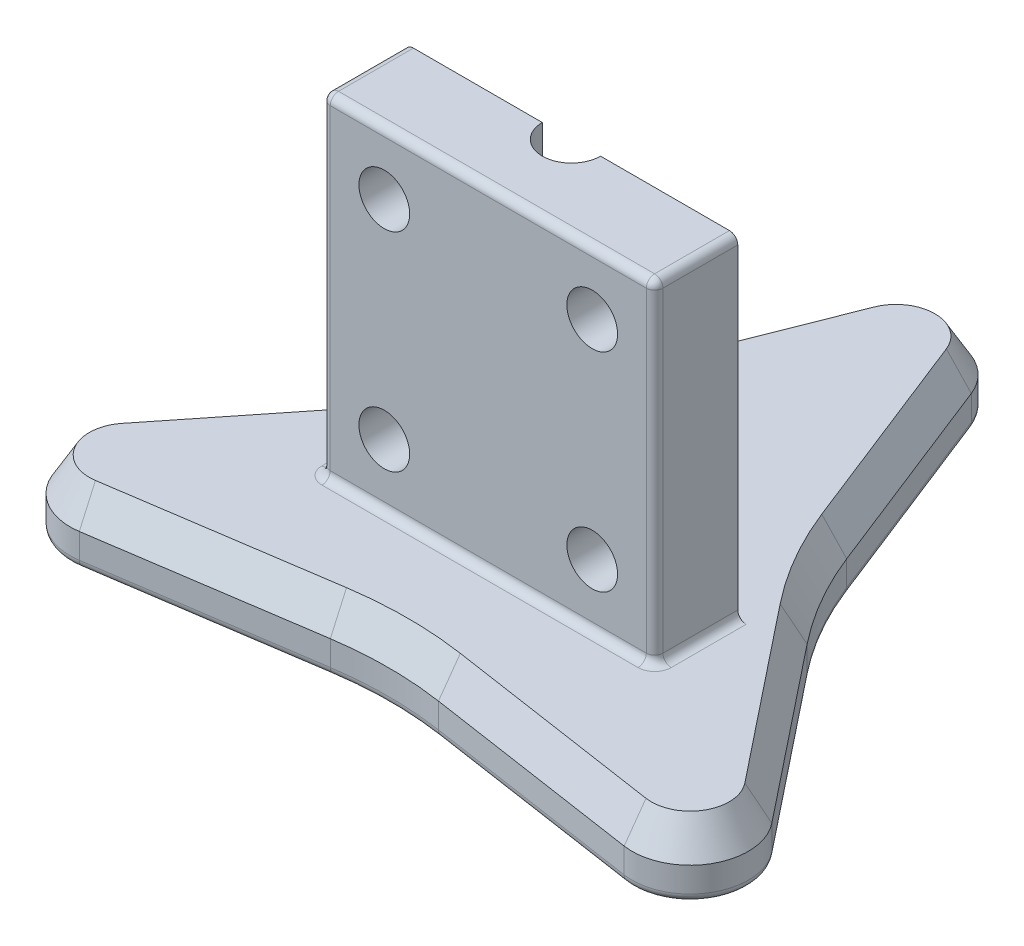
from build123d import *
from OCP.BRepFilletAPI import BRepFilletAPI_MakeChamfer

# Parameters (mm, degrees)
EXTRUDE2_DEPTH     = 8
CHAMFER2_SIZE      = 4
CHAMFER2_SIZE2     = 2.309401077
CUT_EXTRUDE1_DEPTH = 3
EXTRUDE3_START     = 8
EXTRUDE3_DEPTH     = 40
SKETCH4_R          = 3.05
CUT_EXTRUDE2_DEPTH = 78.989993783
FILLET1_R          = 1


with BuildPart() as part:
    # Sketch1 → Extrude2 (new body)
    with BuildSketch(Plane(origin=(0, 0, 0), x_dir=(1, 0, 0), z_dir=(0, 1, 0))):
        with BuildLine():
            Line((-6.5, 41.572883869), (-16.221725084, 16.871170844))
            ThreePointArc((-16.221725084, 16.871170844), (-17.527996386, 13.882959965), (-19.052558883, 11))
            ThreePointArc((-19.052558883, 11), (-20.786994202, 8.238210165), (-22.721725084, 5.612840594))
            Line((-22.721725084, 5.612840594), (-39.253173539, -15.15727681))
            ThreePointArc((-39.253173539, -15.15727681), (-39.837168574, -23), (-32.753173539, -26.415607059))
            Line((-32.753173539, -26.415607059), (-6.5, -22.484011438))
            ThreePointArc((-6.5, -22.484011438), (-3.258997817, -22.12117013), (0, -22))
            ThreePointArc((0, -22), (3.258997817, -22.12117013), (6.5, -22.484011438))
            Line((6.5, -22.484011438), (32.753173539, -26.415607059))
            ThreePointArc((32.753173539, -26.415607059), (39.837168574, -23), (39.253173539, -15.15727681))
            Line((39.253173539, -15.15727681), (22.721725084, 5.612840594))
            ThreePointArc((22.721725084, 5.612840594), (20.786994202, 8.238210165), (19.052558883, 11))
            ThreePointArc((19.052558883, 11), (17.527996386, 13.882959965), (16.221725084, 16.871170844))
            Line((16.221725084, 16.871170844), (6.5, 41.572883869))
            ThreePointArc((6.5, 41.572883869), (0, 46), (-6.5, 41.572883869))
        make_face()
    extrude(amount=EXTRUDE2_DEPTH)

    # Chamfer2: one chamfer whose edges measure the first distance from different faces: ONE call of the kernel's chamfer builder (chamfer() names one face for all edges)
    chamfer2_edges_1 = [part.edges().sort_by_distance(p)[0] for p in [
        (-19.052558883, 8, -11),
    ]]
    chamfer2_side_1 = [part.faces().sort_by_distance(p)[0] for p in [
        (-19.052558883, 4, -11),
    ]]
    chamfer2_edges_2 = [part.edges().sort_by_distance(p)[0] for p in [
        (-30.987449312, 8, 4.772218108),
    ]]
    chamfer2_side_2 = [part.faces().sort_by_distance(p)[0] for p in [
        (-30.987449312, 4, 4.772218108),
    ]]
    chamfer2_edges_3 = [part.edges().sort_by_distance(p)[0] for p in [
        (-39.837168574, 8, 23),
    ]]
    chamfer2_side_3 = [part.faces().sort_by_distance(p)[0] for p in [
        (-39.837168574, 4, 23),
    ]]
    chamfer2_edges_4 = [part.edges().sort_by_distance(p)[0] for p in [
        (-19.626586769, 8, 24.449809248),
    ]]
    chamfer2_side_4 = [part.faces().sort_by_distance(p)[0] for p in [
        (-19.626586769, 4, 24.449809248),
    ]]
    chamfer2_edges_5 = [part.edges().sort_by_distance(p)[0] for p in [
        (0, 8, 22),
    ]]
    chamfer2_side_5 = [part.faces().sort_by_distance(p)[0] for p in [
        (0, 4, 22),
    ]]
    chamfer2_edges_6 = [part.edges().sort_by_distance(p)[0] for p in [
        (19.626586769, 8, 24.449809248),
    ]]
    chamfer2_side_6 = [part.faces().sort_by_distance(p)[0] for p in [
        (19.626586769, 4, 24.449809248),
    ]]
    chamfer2_edges_7 = [part.edges().sort_by_distance(p)[0] for p in [
        (39.837168574, 8, 23),
    ]]
    chamfer2_side_7 = [part.faces().sort_by_distance(p)[0] for p in [
        (39.837168574, 4, 23),
    ]]
    chamfer2_edges_8 = [part.edges().sort_by_distance(p)[0] for p in [
        (30.987449312, 8, 4.772218108),
    ]]
    chamfer2_side_8 = [part.faces().sort_by_distance(p)[0] for p in [
        (30.987449312, 4, 4.772218108),
    ]]
    chamfer2_edges_9 = [part.edges().sort_by_distance(p)[0] for p in [
        (0, 8, -46),
    ]]
    chamfer2_side_9 = [part.faces().sort_by_distance(p)[0] for p in [
        (0, 4, -46),
    ]]
    chamfer2_edges_10 = [part.edges().sort_by_distance(p)[0] for p in [
        (19.052558883, 8, -11),
    ]]
    chamfer2_side_10 = [part.faces().sort_by_distance(p)[0] for p in [
        (19.052558883, 4, -11),
    ]]
    chamfer2_edges_11 = [part.edges().sort_by_distance(p)[0] for p in [
        (11.360862542, 8, -29.222027356),
    ]]
    chamfer2_side_11 = [part.faces().sort_by_distance(p)[0] for p in [
        (11.360862542, 4, -29.222027356),
    ]]
    chamfer2_edges_12 = [part.edges().sort_by_distance(p)[0] for p in [
        (-11.360862542, 8, -29.222027356),
    ]]
    chamfer2_side_12 = [part.faces().sort_by_distance(p)[0] for p in [
        (-11.360862542, 4, -29.222027356),
    ]]
    chamfer2 = BRepFilletAPI_MakeChamfer(part.part.solid().wrapped)
    for e in chamfer2_edges_1:
        chamfer2.Add(CHAMFER2_SIZE, CHAMFER2_SIZE2, e.wrapped, chamfer2_side_1[0].wrapped)  # the first distance lies on this face
    for e in chamfer2_edges_2:
        chamfer2.Add(CHAMFER2_SIZE, CHAMFER2_SIZE2, e.wrapped, chamfer2_side_2[0].wrapped)  # the first distance lies on this face
    for e in chamfer2_edges_3:
        chamfer2.Add(CHAMFER2_SIZE, CHAMFER2_SIZE2, e.wrapped, chamfer2_side_3[0].wrapped)  # the first distance lies on this face
    for e in chamfer2_edges_4:
        chamfer2.Add(CHAMFER2_SIZE, CHAMFER2_SIZE2, e.wrapped, chamfer2_side_4[0].wrapped)  # the first distance lies on this face
    for e in chamfer2_edges_5:
        chamfer2.Add(CHAMFER2_SIZE, CHAMFER2_SIZE2, e.wrapped, chamfer2_side_5[0].wrapped)  # the first distance lies on this face
    for e in chamfer2_edges_6:
        chamfer2.Add(CHAMFER2_SIZE, CHAMFER2_SIZE2, e.wrapped, chamfer2_side_6[0].wrapped)  # the first distance lies on this face
    for e in chamfer2_edges_7:
        chamfer2.Add(CHAMFER2_SIZE, CHAMFER2_SIZE2, e.wrapped, chamfer2_side_7[0].wrapped)  # the first distance lies on this face
    for e in chamfer2_edges_8:
        chamfer2.Add(CHAMFER2_SIZE, CHAMFER2_SIZE2, e.wrapped, chamfer2_side_8[0].wrapped)  # the first distance lies on this face
    for e in chamfer2_edges_9:
        chamfer2.Add(CHAMFER2_SIZE, CHAMFER2_SIZE2, e.wrapped, chamfer2_side_9[0].wrapped)  # the first distance lies on this face
    for e in chamfer2_edges_10:
        chamfer2.Add(CHAMFER2_SIZE, CHAMFER2_SIZE2, e.wrapped, chamfer2_side_10[0].wrapped)  # the first distance lies on this face
    for e in chamfer2_edges_11:
        chamfer2.Add(CHAMFER2_SIZE, CHAMFER2_SIZE2, e.wrapped, chamfer2_side_11[0].wrapped)  # the first distance lies on this face
    for e in chamfer2_edges_12:
        chamfer2.Add(CHAMFER2_SIZE, CHAMFER2_SIZE2, e.wrapped, chamfer2_side_12[0].wrapped)  # the first distance lies on this face
    add(Compound.cast(chamfer2.Shape()), mode=Mode.REPLACE)

    # Sketch2 → Cut-Extrude1 (cut)
    with BuildSketch(Plane(origin=(0, 0, 0), x_dir=(1, 0, 0), z_dir=(0, 1, 0))):
        with BuildLine():
            ThreePointArc((-33.06983816, -24.960303026), (-38.550871935, -22.25735629), (-38.151175585, -16.159168435))
            ThreePointArc((-38.151175585, -16.159168435), (-36.048003444, -15.88228057), (-35.771115574, -17.985452713))
            ThreePointArc((-35.771115574, -17.985452713), (-35.952795735, -20.757356297), (-33.461416734, -21.985968456))
            ThreePointArc((-33.461416734, -21.985968456), (-31.778460163, -23.277346457), (-33.06983816, -24.960303026))
        make_face()
        with BuildLine():
            ThreePointArc((-5.081337427, 41.119471458), (0, 44.514712578), (5.081337424, 41.119471458))
            ThreePointArc((5.081337424, 41.119471458), (4.269543279, 39.159627023), (2.309698839, 39.971421166))
            ThreePointArc((2.309698839, 39.971421166), (0, 41.514712592), (-2.309698842, 39.971421166))
            ThreePointArc((-2.309698842, 39.971421166), (-4.269543282, 39.159627023), (-5.081337427, 41.119471458))
        make_face()
        with BuildLine():
            ThreePointArc((38.151175587, -16.159168432), (38.550871936, -22.257356289), (33.069838162, -24.960303024))
            ThreePointArc((33.069838162, -24.960303024), (31.778460165, -23.277346454), (33.461416736, -21.985968453))
            ThreePointArc((33.461416736, -21.985968453), (35.952795736, -20.757356296), (35.771115577, -17.985452711))
            ThreePointArc((35.771115577, -17.985452711), (36.048003446, -15.882280567), (38.151175587, -16.159168432))
        make_face()
    extrude(amount=CUT_EXTRUDE1_DEPTH, mode=Mode.SUBTRACT)

    # Sketch3 → Extrude3 (add)
    with BuildSketch(Plane(origin=(0, 0, 0), x_dir=(1, 0, 0), z_dir=(0, 1, 0)).offset(EXTRUDE3_START)):
        with BuildLine():
            Line((-20, 0), (-20, -10))
            Line((-20, -10), (20, -10))
            Line((20, -10), (20, 0))
            Line((20, 0), (3.5, 0))
            ThreePointArc((3.5, 0), (0, -3.5), (-3.5, 0))
            Line((-3.5, 0), (-20, 0))
        make_face()
    extrude(amount=EXTRUDE3_DEPTH)

    # Sketch4 → Cut-Extrude2 (cut, through all)
    with BuildSketch(Plane.XY):
        with Locations(Location((-12.5, 40.5, 0), (0, 0, 180))):
            Circle(SKETCH4_R)
        with Locations(Location((12.5, 40.5, 0), (0, 0, 180))):
            Circle(SKETCH4_R)
        with Locations(Location((12.5, 15.5, 0), (0, 0, 180))):
            Circle(SKETCH4_R)
        with Locations(Location((-12.5, 15.5, 0), (0, 0, 180))):
            Circle(SKETCH4_R)
    extrude(amount=CUT_EXTRUDE2_DEPTH, mode=Mode.SUBTRACT)

    # Fillet1
    fillet1_edges = [part.edges().sort_by_distance(p)[0] for p in [
        (-20, 8, 5),
        (11.360862542, 0, -29.222027356),
        (0, 8, 10),
        (-20, 28, 10),
        (20, 8, 5),
        (20, 28, 10),
        (-20, 48, 5),
        (0, 48, 10),
        (20, 48, 5),
        (19.052558883, 0, -11),
        (30.987449312, 0, 4.772218108),
        (39.837168574, 0, 23),
        (19.626586769, 0, 24.449809248),
        (0, 0, 22),
        (-19.626586769, 0, 24.449809248),
        (-39.837168574, 0, 23),
        (-30.987449312, 0, 4.772218108),
        (-19.052558883, 0, -11),
        (-11.360862542, 0, -29.222027356),
        (0, 0, -46),
    ]]
    fillet(fillet1_edges, radius=FILLET1_R)


solid = part.part
